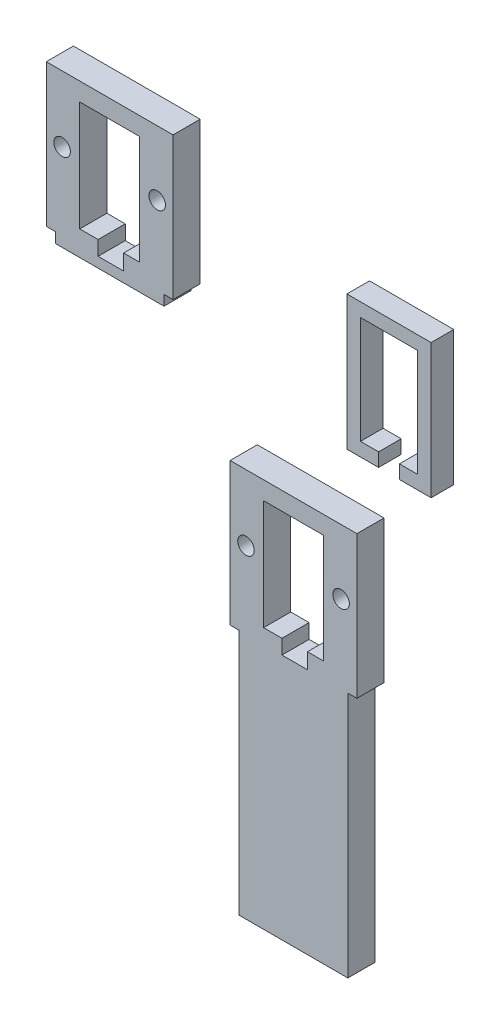
from build123d import *

# Parameters (mm, degrees)
SKETCH1_R           = 1.825
BOSS_EXTRUDE1_DEPTH = 6
SKETCH3_R           = 1.825
BOSS_EXTRUDE2_DEPTH = 6
BOSS_EXTRUDE3_DEPTH = 5


with BuildPart() as part:
    # Sketch1 → Boss-Extrude1 (new body)
    with BuildSketch(Plane.XY):
        Polygon((3.767928447, -62.86956086), (-8.232071553, -62.86956086), (-8.232071553, -8.37428403), (-10.232071553, -8.37428403), (-10.232071553, 23.13043914), (-8.232071553, 23.13043914), (3.767928447, 23.13043914), (15.767928447, 23.13043914), (17.767928447, 23.13043914), (17.767928447, -8.37428403), (15.767928447, -8.37428403), (15.767928447, -62.86956086), align=None)
        with Locations((-6.732071553, 8.575211091)):
            Circle(SKETCH1_R, mode=Mode.SUBTRACT)
        with Locations((14.267928447, 8.870590402)):
            Circle(SKETCH1_R, mode=Mode.SUBTRACT)
        Polygon((3.767928447, 19.13043914), (-2.842071553, 19.13043914), (-2.842071553, -5.15956086), (1.21363058, -5.15956086), (1.21363058, -8.37428403), (6.844888712, -8.37428403), (6.844888712, -4.91956086), (10.377928447, -4.91956086), (10.377928447, 19.13043914), align=None, mode=Mode.SUBTRACT)
    extrude(amount=BOSS_EXTRUDE1_DEPTH)


with BuildPart() as body_2:
    # Sketch3 → Boss-Extrude2 (new body)
    with BuildSketch(Plane.XY):
        Polygon((-36.844661852, 45.324982103), (-48.844661852, 45.324982103), (-48.844661852, 47.59819619), (-50.844661852, 47.59819619), (-50.844661852, 79.10291936), (-48.844661852, 79.10291936), (-36.844661852, 79.10291936), (-24.844661852, 79.10291936), (-22.844661852, 79.10291936), (-22.844661852, 47.59819619), (-24.844661852, 47.59819619), (-24.844661852, 45.324982103), align=None)
        with Locations((-47.344661852, 64.547691311)):
            Circle(SKETCH3_R, mode=Mode.SUBTRACT)
        with Locations((-26.344661852, 64.843070622)):
            Circle(SKETCH3_R, mode=Mode.SUBTRACT)
        Polygon((-36.844661852, 75.10291936), (-43.449661852, 75.10291936), (-43.449661852, 50.81291936), (-39.393959719, 50.81291936), (-39.393959719, 47.59819619), (-33.762701587, 47.59819619), (-33.762701587, 51.05291936), (-30.239661852, 51.05291936), (-30.239661852, 75.10291936), align=None, mode=Mode.SUBTRACT)
    extrude(amount=BOSS_EXTRUDE2_DEPTH)


with BuildPart() as body_3:
    # Sketch4 → Boss-Extrude3 (new body)
    with BuildSketch(Plane.XY):
        Polygon((14.559138473, 66.878973496), (33.159138473, 66.878973496), (33.159138473, 37.178973496), (26.159138473, 37.178973496), (26.159138473, 40.178973496), (30.159138473, 40.178973496), (30.159138473, 63.878973496), (17.559138473, 63.878973496), (17.559138473, 40.178973496), (21.559138473, 40.178973496), (21.559138473, 37.178973496), (14.559138473, 37.178973496), align=None)
    extrude(amount=BOSS_EXTRUDE3_DEPTH)


solid = Compound([part.part, body_2.part, body_3.part])
